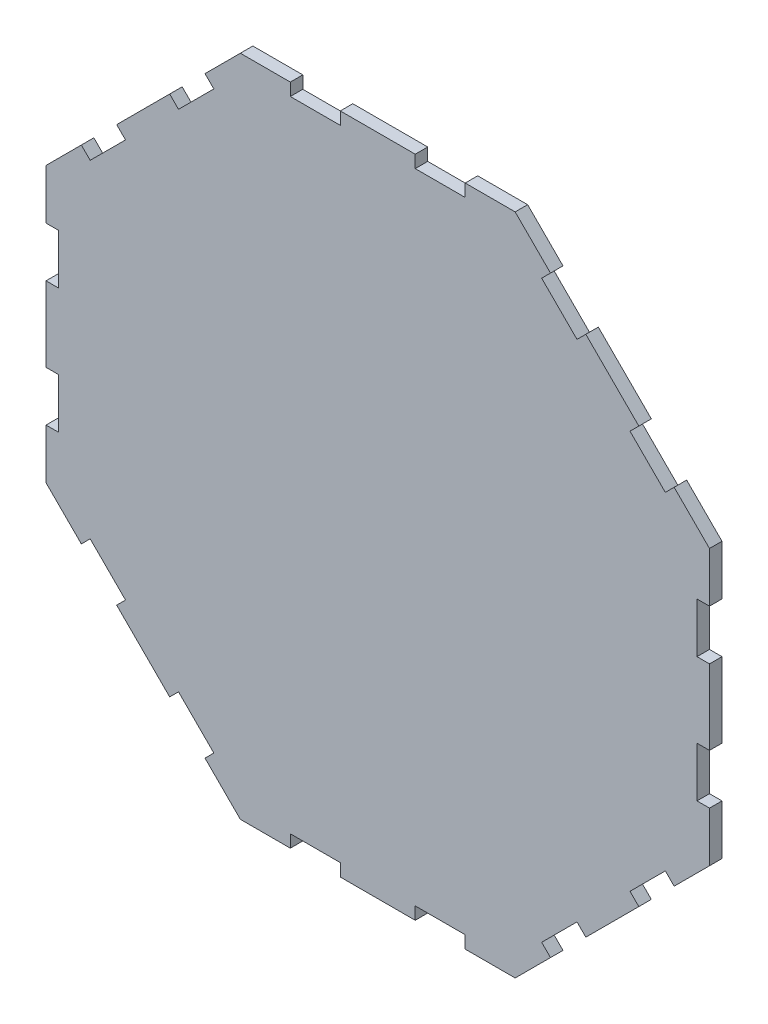
from build123d import *

# Parameters (mm, degrees)
BOSS_EXTRUDE1_DEPTH = 3.175


with BuildPart() as part:
    # Sketch1 → Boss-Extrude1 (new body)
    with BuildSketch(Plane.XY):
        Polygon((50.640448212, 64.110832393), (41.660192091, 73.091088515), (43.905256121, 75.336152545), (34.925, 84.316408666), (22.225, 84.316408666), (22.225, 81.141408666), (9.525, 81.141408666), (9.525, 84.316408666), (-9.525, 84.316408666), (-9.525, 81.141408666), (-22.225, 81.141408666), (-22.225, 84.316408666), (-34.925, 84.316408666), (-43.905256121, 75.336152545), (-41.660192091, 73.091088515), (-50.640448212, 64.110832393), (-52.885512242, 66.355896424), (-66.355896424, 52.885512242), (-64.110832393, 50.640448212), (-73.091088515, 41.660192091), (-75.336152545, 43.905256121), (-84.316408666, 34.925), (-84.316408666, 22.225), (-81.141408666, 22.225), (-81.141408666, 9.525), (-84.316408666, 9.525), (-84.316408666, -9.525), (-81.141408666, -9.525), (-81.141408666, -22.225), (-84.316408666, -22.225), (-84.316408666, -34.925), (-75.336152545, -43.905256121), (-73.091088515, -41.660192091), (-64.110832393, -50.640448212), (-66.355896424, -52.885512242), (-52.885512242, -66.355896424), (-50.640448212, -64.110832393), (-41.660192091, -73.091088515), (-43.905256121, -75.336152545), (-34.925, -84.316408666), (-22.225, -84.316408666), (-22.225, -81.141408666), (-9.525, -81.141408666), (-9.525, -84.316408666), (9.525, -84.316408666), (9.525, -81.141408666), (22.225, -81.141408666), (22.225, -84.316408666), (34.925, -84.316408666), (43.905256121, -75.336152545), (41.660192091, -73.091088515), (50.640448212, -64.110832393), (52.885512242, -66.355896424), (66.355896424, -52.885512242), (64.110832393, -50.640448212), (73.091088515, -41.660192091), (75.336152545, -43.905256121), (84.316408666, -34.925), (84.316408666, -22.225), (81.141408666, -22.225), (81.141408666, -9.525), (84.316408666, -9.525), (84.316408666, 9.525), (81.141408666, 9.525), (81.141408666, 22.225), (84.316408666, 22.225), (84.316408666, 34.925), (75.336152545, 43.905256121), (73.091088515, 41.660192091), (64.110832393, 50.640448212), (66.355896424, 52.885512242), (52.885512242, 66.355896424), align=None)
    extrude(amount=BOSS_EXTRUDE1_DEPTH)


solid = part.part
